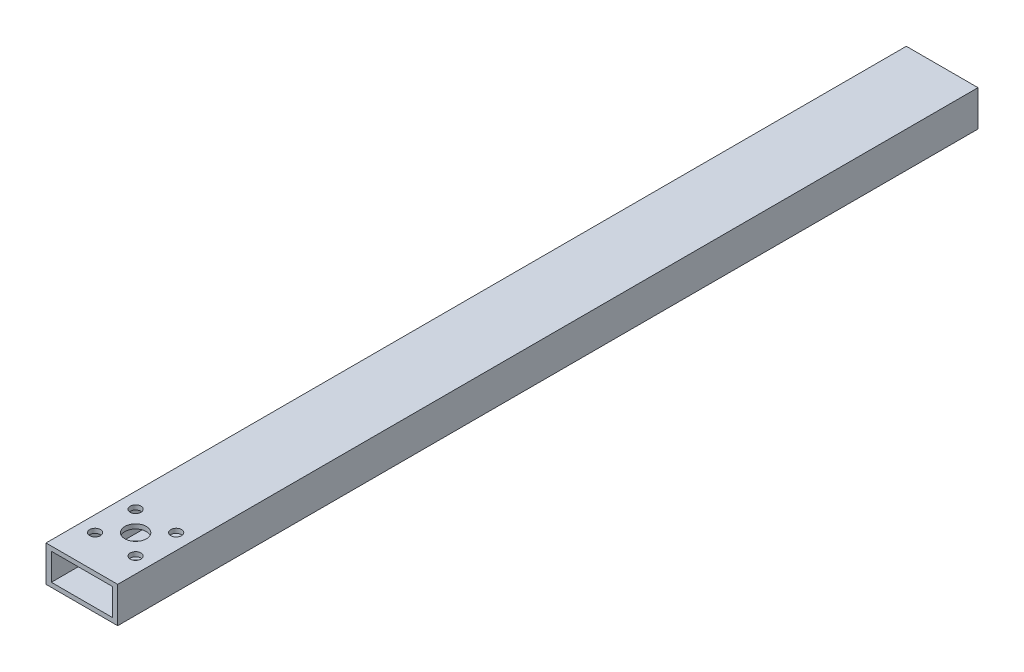
from build123d import *

# Parameters (mm, degrees)
SKETCH_1_W          = 20
SKETCH_1_H          = 10
SKETCH_1_W_2        = 17
SKETCH_1_H_2        = 7.5
EXTRUDE_1_DEPTH     = 200
SKETCH_3_R          = 3
CUT_EXTRUDE_2_DEPTH = 10
SKETCH_5_R          = 1.5
CUT_EXTRUDE_4_DEPTH = 10
SKETCH_6_W          = 20
SKETCH_6_H          = 10
SKETCH_6_W_2        = 17
SKETCH_6_H_2        = 7.5
EXTRUDE_2_DEPTH     = 40


with BuildPart() as part:
    # 草图1 → 凸台-拉伸1 (new body)
    with BuildSketch(Plane.XY):
        Rectangle(SKETCH_1_W, SKETCH_1_H)
        Rectangle(SKETCH_1_W_2, SKETCH_1_H_2, mode=Mode.SUBTRACT)
    extrude(amount=EXTRUDE_1_DEPTH)

    # 草图3 → 切除-拉伸2 (cut)
    with BuildSketch(Plane.XZ.offset(5)):
        with Locations(Location((0, 185, 0), (0, 0, 270))):
            Circle(SKETCH_3_R)
    extrude(amount=-CUT_EXTRUDE_2_DEPTH, mode=Mode.SUBTRACT)

    # 草图5 → 切除-拉伸4 (cut)
    with BuildSketch(Plane.XZ.offset(5)):
        with Locations(Location((5.656854249, 190.656854249, 0), (0, 0, 270))):
            Circle(SKETCH_5_R)
        with Locations(Location((5.656854249, 179.343145751, 0), (0, 0, 270))):
            Circle(SKETCH_5_R)
        with Locations(Location((-5.656854249, 179.343145751, 0), (0, 0, 270))):
            Circle(SKETCH_5_R)
        with Locations(Location((-5.656854249, 190.656854249, 0), (0, 0, 270))):
            Circle(SKETCH_5_R)
    extrude(amount=-CUT_EXTRUDE_4_DEPTH, mode=Mode.SUBTRACT)

    # 草图6 → 凸台-拉伸2 (add)
    with BuildSketch(Plane(origin=(0, 0, 0), x_dir=(-1, 0, 0), z_dir=(0, 0, -1))):
        Rectangle(SKETCH_6_W, SKETCH_6_H)
        Rectangle(SKETCH_6_W_2, SKETCH_6_H_2, mode=Mode.SUBTRACT)
    extrude(amount=EXTRUDE_2_DEPTH)


solid = part.part
